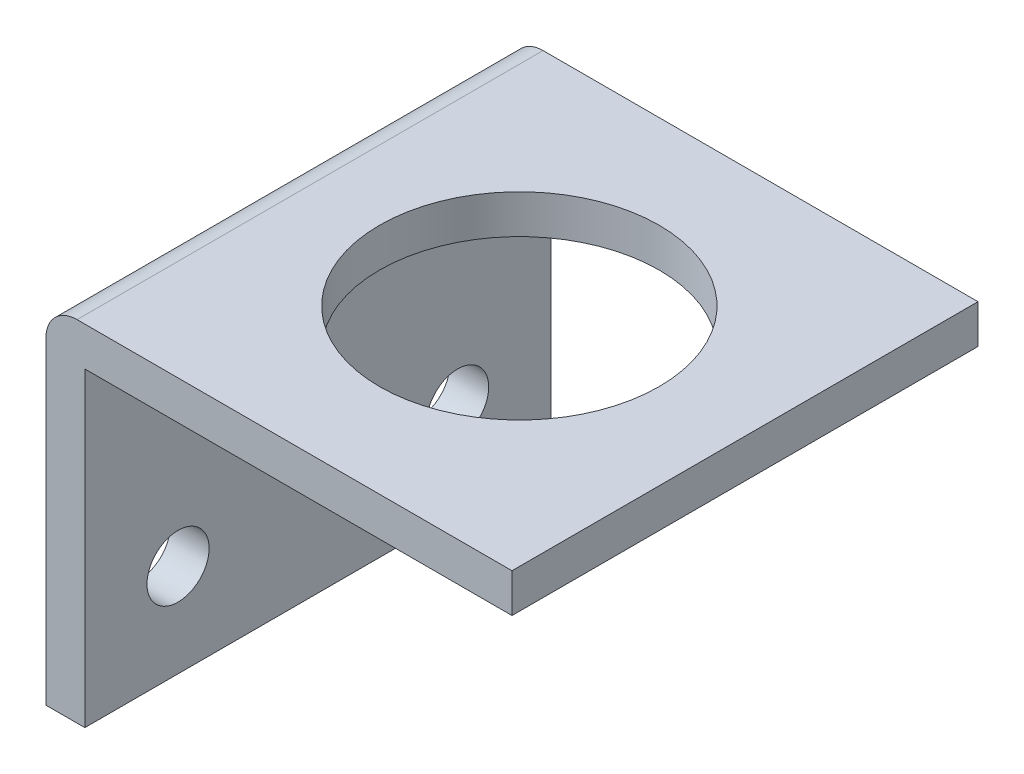
from build123d import *

# Parameters (mm, degrees)
SKETCH1_W           = 3.175
SKETCH1_H           = 25.4
BOSS_EXTRUDE1_DEPTH = 38.1
FILLET1_R           = 2.54
SKETCH2_R           = 11.43
CUT_EXTRUDE1_DEPTH  = 38.1
SKETCH3_R           = 2.54
CUT_EXTRUDE3_DEPTH  = 61.989758362


with BuildPart() as part:
    # Sketch1 → Boss-Extrude1 (new body)
    with BuildSketch(Plane.XY):
        Polygon((0, 28.575), (0, 25.4), (3.175, 25.4), (38.1, 25.4), (38.1, 28.575), align=None)
        with Locations((1.5875, 12.7)):
            Rectangle(SKETCH1_W, SKETCH1_H)
    extrude(amount=BOSS_EXTRUDE1_DEPTH)

    # Fillet1
    fillet1_edges = [part.edges().sort_by_distance(p)[0] for p in [
        (0, 28.575, 19.05),
    ]]
    fillet(fillet1_edges, radius=FILLET1_R)

    # Sketch2 → Cut-Extrude1 (cut)
    with BuildSketch(Plane(origin=(0, 28.575, 0), x_dir=(1, 0, 0), z_dir=(0, 1, 0))):
        with Locations(Location((19.649884534, -19.05, 0), (0, 0, 270))):
            Circle(SKETCH2_R)
    extrude(amount=-CUT_EXTRUDE1_DEPTH, mode=Mode.SUBTRACT)

    # Sketch3 → Cut-Extrude3 (cut, through all)
    with BuildSketch(Plane.ZY):
        with Locations((7.62, 7.62)):
            Circle(SKETCH3_R)
        with Locations((30.48, 7.62)):
            Circle(SKETCH3_R)
    extrude(amount=-CUT_EXTRUDE3_DEPTH, mode=Mode.SUBTRACT)


solid = part.part
